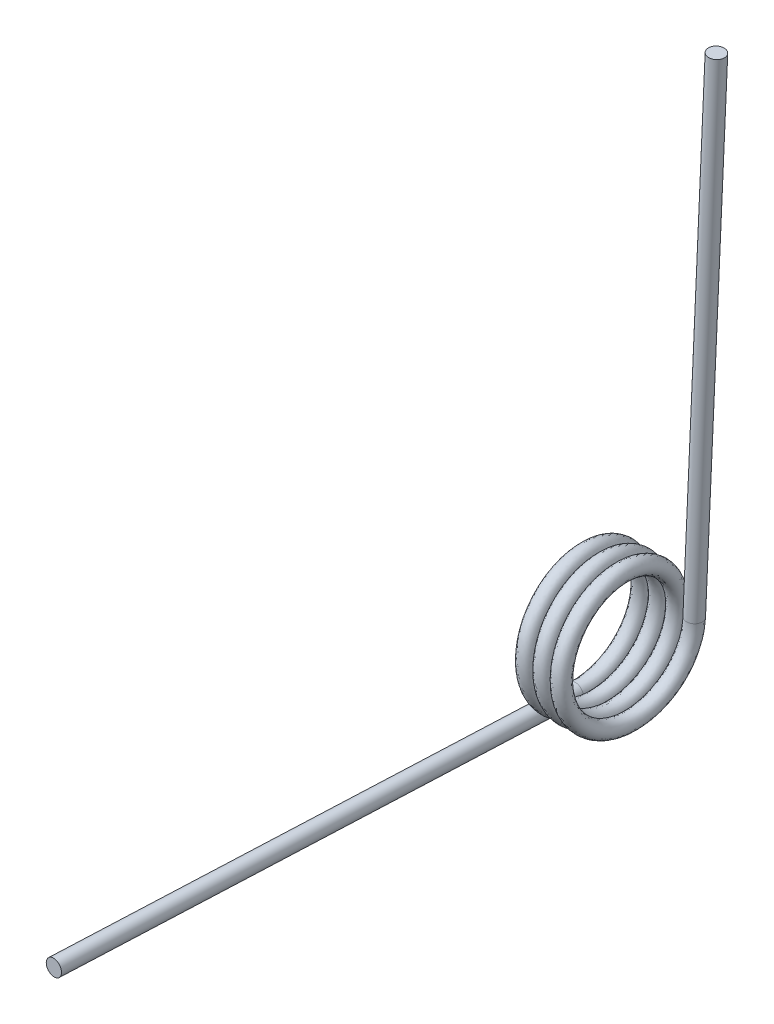
from build123d import *

# Parameters (mm, degrees)
SWEEP1_PITCH       = 0.3302
SWEEP1_HEIGHT      = 1.07315
SWEEP1_RADIUS      = 1.1811
SWEEP1_START_ANGLE = 90
SKETCH2_R          = 0.1524
SKETCH3_R          = 0.1524
EXTRUDE1_DEPTH     = 9.525
SKETCH4_R          = 0.1524
EXTRUDE2_DEPTH     = 9.525


with BuildPart() as part:
    # Sweep1: sweep along a helix
    with BuildLine() as sweep1_path:
        add(Helix(SWEEP1_PITCH, SWEEP1_HEIGHT, SWEEP1_RADIUS, center=(0, 0, 0), direction=(1, 0, 0), mode=Mode.PRIVATE).rotate(Axis((0, 0, 0), (1, 0, 0)), SWEEP1_START_ANGLE))
    # Sketch2 → Sweep1 (sweep)
    with BuildSketch(Plane(origin=(0, -1.1811, 0), x_dir=(0.9950232631069807, 0.08926681293390734, 0.044273490765457786), z_dir=(0.04445095011459732, 1.106753577673203e-14, -0.9990115680180633))):
        Circle(SKETCH2_R)
    sweep(path=sweep1_path.line, is_frenet=True)

    # Sketch3 → Extrude1 (add)
    with BuildSketch(Plane(origin=(0, 0, 0), x_dir=(-0.9950232631069807, -0.08926681293390734, -0.04427349076545777), z_dir=(-0.04445095011459731, -1.106753577673203e-14, 0.9990115680180633))):
        with Locations(Location((0.105433033, 1.176384752, 0), (0, 0, 354.87857121))):
            Circle(SKETCH3_R)
    extrude(amount=EXTRUDE1_DEPTH)

    # Sketch4 → Extrude2 (add)
    with BuildSketch(Plane(origin=(0.002120423, 0.047655386, 0), x_dir=(0.9950232631069817, -0.04427349076545195, -0.08926681293389839), z_dir=(0.044450950114597314, 0.9990115680180633, 5.463598323762753e-14))):
        with Locations(Location((1.173242248, 1.080682761, 0), (0, 0, 174.87857121))):
            Circle(SKETCH4_R)
    extrude(amount=EXTRUDE2_DEPTH)


solid = part.part
